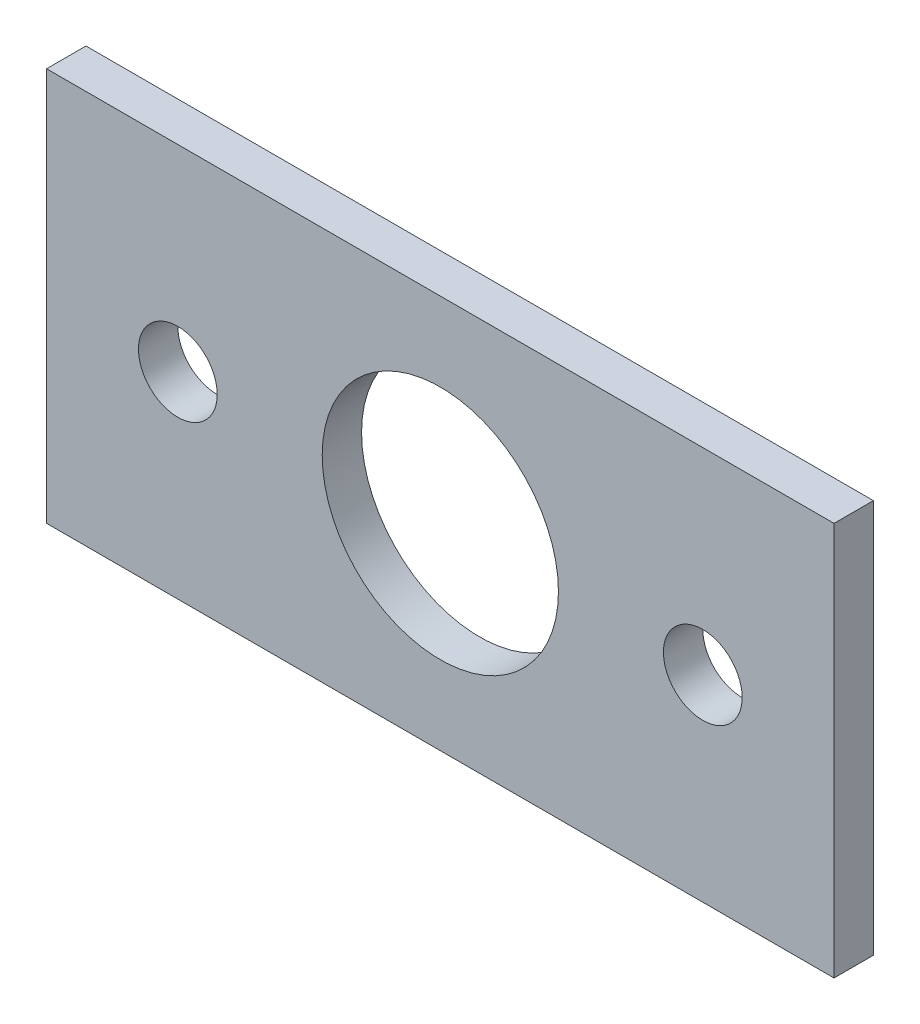
from build123d import *

# Parameters (mm, degrees)
ESQUISSE1_W      = 30
ESQUISSE1_H      = 15
ESQUISSE1_R      = 4.5
ESQUISSE1_R_2    = 1.5
EXTRUSION1_DEPTH = 1.5


with BuildPart() as part:
    # Esquisse1 → Extrusion1 (new body)
    with BuildSketch(Plane.XY):
        with Locations((-11.863107432, 5.681894737)):
            Rectangle(ESQUISSE1_W, ESQUISSE1_H)
        with Locations((-11.863107432, 5.681894737)):
            Circle(ESQUISSE1_R, mode=Mode.SUBTRACT)
        with Locations((-21.863107432, 5.681894737)):
            Circle(ESQUISSE1_R_2, mode=Mode.SUBTRACT)
        with Locations((-1.863107432, 5.681894737)):
            Circle(ESQUISSE1_R_2, mode=Mode.SUBTRACT)
    extrude(amount=EXTRUSION1_DEPTH)


solid = part.part
